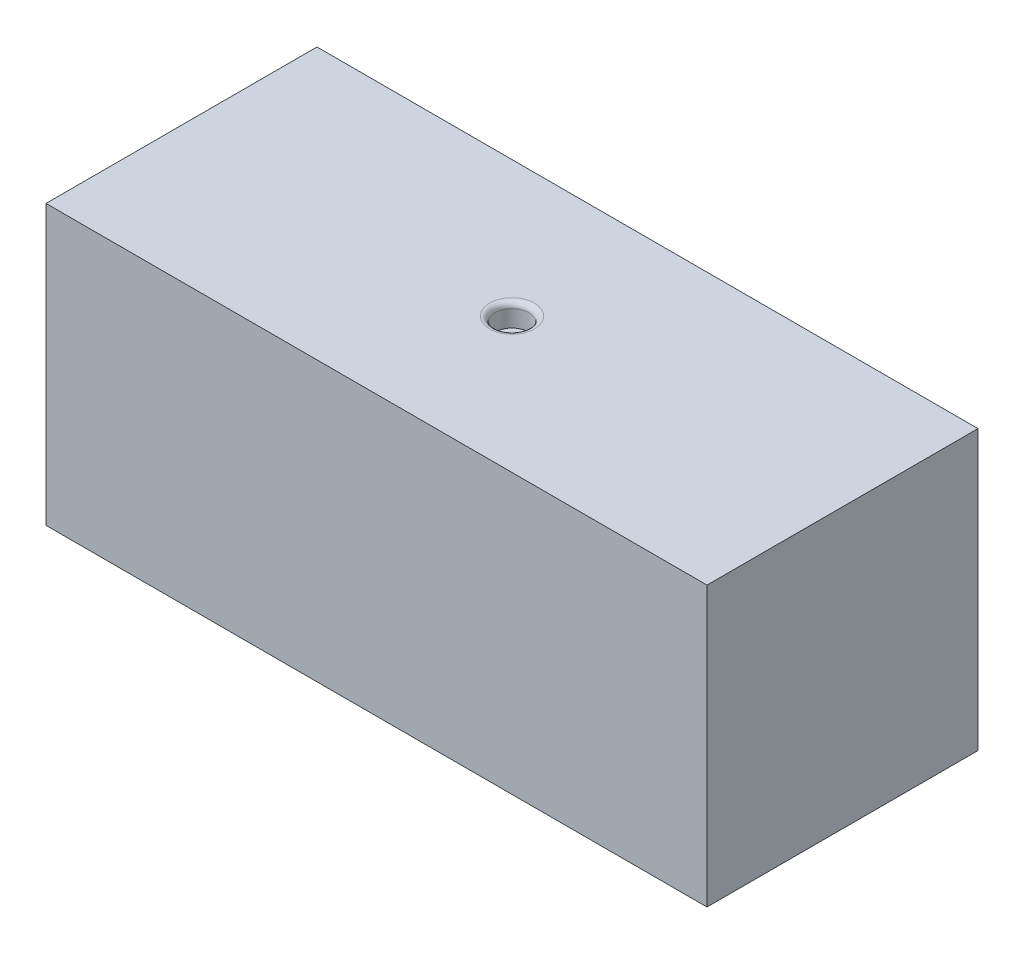
from build123d import *

# Parameters (mm, degrees)
SKETCH1_W           = 177.8
SKETCH1_H           = 254
BOSS_EXTRUDE1_DEPTH = 36.445
SHELL1_T            = 3
SKETCH2_R           = 22
CUT_EXTRUDE1_DEPTH  = 3
SKETCH3_R           = 5
CUT_EXTRUDE2_DEPTH  = 3
SKETCH12_W          = 12
SKETCH12_H          = 66.89
BOSS_EXTRUDE5_DEPTH = 6
SKETCH10_R          = 4.525
CUT_EXTRUDE8_DEPTH  = 6
SKETCH13_W          = 174.8
SKETCH13_H          = 69.89
SKETCH13_W_2        = 171.8
SKETCH13_H_2        = 66.89
BOSS_EXTRUDE6_DEPTH = 10
SKETCH14_W          = 175.3
SKETCH14_H          = 70.39
SKETCH14_W_2        = 171.8
SKETCH14_H_2        = 66.89
CUT_EXTRUDE9_DEPTH  = 25
SKETCH17_W          = 171.8
SKETCH17_H          = 66.89
BOSS_EXTRUDE7_DEPTH = 2
SKETCH15_R          = 8.05
CUT_EXTRUDE10_DEPTH = 5
SKETCH18_R          = 2.875
CUT_EXTRUDE11_DEPTH = 4.7
FILLET1_R           = 1.5


with BuildPart() as part:
    # Sketch1 → Boss-Extrude1 (new, symmetric)
    with BuildSketch(Plane.XY):
        Rectangle(SKETCH1_W, SKETCH1_H)
    extrude(amount=BOSS_EXTRUDE1_DEPTH, both=True)

    # Shell1 (no face opened: a closed hollow body)
    add(offset(amount=-SHELL1_T, mode=Mode.PRIVATE), mode=Mode.SUBTRACT)

    # Sketch2 → Cut-Extrude1 (cut)
    with BuildSketch(Plane(origin=(0, 0, 33.445), x_dir=(-1, 0, 0), z_dir=(0, 0, -1))):
        with Locations((0, -4)):
            Circle(SKETCH2_R)
    extrude(amount=-CUT_EXTRUDE1_DEPTH, mode=Mode.SUBTRACT)

    # Sketch3 → Cut-Extrude2 (cut)
    with BuildSketch(Plane.XY.offset(-33.445)):
        with Locations((-20.9, 34)):
            Circle(SKETCH3_R)
    extrude(amount=-CUT_EXTRUDE2_DEPTH, mode=Mode.SUBTRACT)

    # Sketch12 → Boss-Extrude5 (add)
    with BuildSketch(Plane.XZ.offset(-124)):
        Rectangle(SKETCH12_W, SKETCH12_H)
    extrude(amount=BOSS_EXTRUDE5_DEPTH)

    # Sketch10 → Cut-Extrude8 (cut)
    with BuildSketch(Plane(origin=(0, 127, 0), x_dir=(1, 0, 0), z_dir=(0, 1, 0))):
        with Locations(Location((0, 0, 0), (0, 0, 270))):
            Circle(SKETCH10_R)
    extrude(amount=-CUT_EXTRUDE8_DEPTH, mode=Mode.SUBTRACT)


with BuildPart() as body_2:
    # Split2: the piece on the far side of the plane
    add(part.part)
    split(bisect_by=Plane.ZX.offset(52), keep=Keep.BOTTOM)

    # Sketch13 → Boss-Extrude6 (add)
    with BuildSketch(Plane(origin=(0, 52, 0), x_dir=(1, 0, 0), z_dir=(0, 1, 0))):
        Rectangle(SKETCH13_W, SKETCH13_H)
        Rectangle(SKETCH13_W_2, SKETCH13_H_2, mode=Mode.SUBTRACT)
    extrude(amount=BOSS_EXTRUDE6_DEPTH)

    # Sketch17 → Boss-Extrude7 (add)
    with BuildSketch(Plane(origin=(0, -124, 0), x_dir=(1, 0, 0), z_dir=(0, 1, 0))):
        Rectangle(SKETCH17_W, SKETCH17_H)
    extrude(amount=BOSS_EXTRUDE7_DEPTH)

    # Sketch15 → Cut-Extrude10 (cut)
    with BuildSketch(Plane.XZ.offset(127)):
        with Locations(Location((0, 0, 0), (0, 0, 270))):
            Circle(SKETCH15_R)
    extrude(amount=-CUT_EXTRUDE10_DEPTH, mode=Mode.SUBTRACT)

    # Sketch18 → Cut-Extrude11 (cut)
    with BuildSketch(Plane.XZ.offset(127)):
        with Locations(Location((-7.778174593, 7.778174593, 0), (0, 0, 270))):
            Circle(SKETCH18_R)
        with Locations(Location((7.778174593, 7.778174593, 0), (0, 0, 270))):
            Circle(SKETCH18_R)
        with Locations(Location((7.778174593, -7.778174593, 0), (0, 0, 270))):
            Circle(SKETCH18_R)
        with Locations(Location((-7.778174593, -7.778174593, 0), (0, 0, 270))):
            Circle(SKETCH18_R)
    extrude(amount=-CUT_EXTRUDE11_DEPTH, mode=Mode.SUBTRACT)


with BuildPart() as part_1:
    add(part.part)

    # Split2
    split(bisect_by=Plane.ZX.offset(52), keep=Keep.TOP)

    # Sketch14 → Cut-Extrude9 (cut)
    with BuildSketch(Plane.XZ.offset(-52)):
        Rectangle(SKETCH14_W, SKETCH14_H)
        Rectangle(SKETCH14_W_2, SKETCH14_H_2, mode=Mode.SUBTRACT)
    extrude(amount=-CUT_EXTRUDE9_DEPTH, mode=Mode.SUBTRACT)

    # Fillet1
    fillet1_edges = [part_1.edges().sort_by_distance(p)[0] for p in [
        (0, 127, -4.525),
    ]]
    fillet(fillet1_edges, radius=FILLET1_R)


solid = part_1.part
